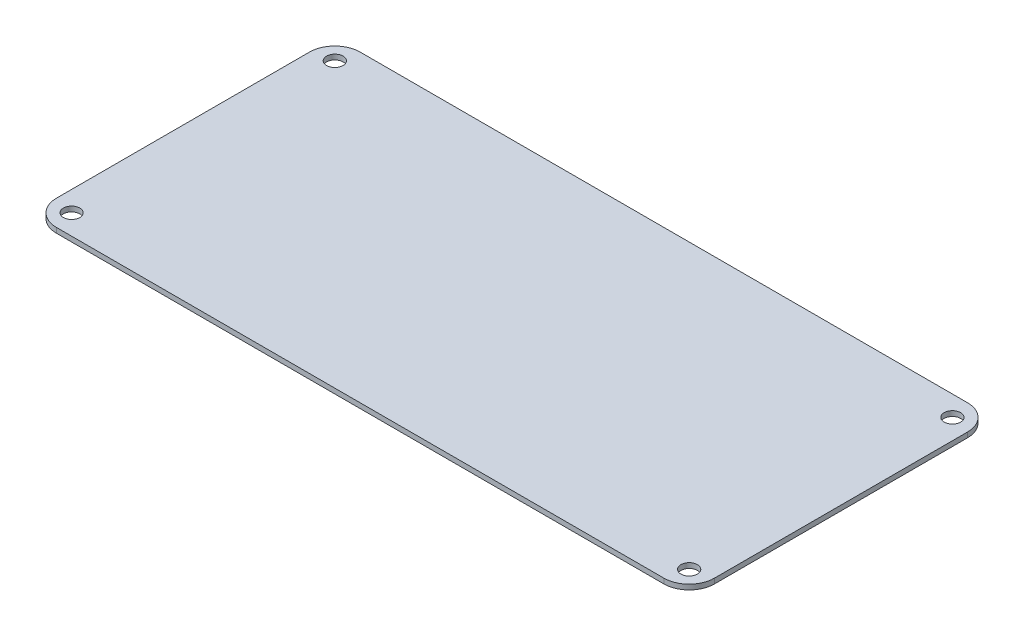
from build123d import *

# Parameters (mm, degrees)
EXTRUDE_1_DEPTH     = 2
SKETCH_3_R          = 3.25
CUT_EXTRUDE_2_DEPTH = 15


with BuildPart() as part:
    # 草图1 → 凸台-拉伸1 (new body)
    with BuildSketch(Plane(origin=(0, 0, 0), x_dir=(1, 0, 0), z_dir=(0, 1, 0))):
        with BuildLine():
            Line((-130, 50), (-130, -50))
            ThreePointArc((-130, -50), (-127.071067812, -57.071067812), (-120, -60))
            Line((-120, -60), (120, -60))
            ThreePointArc((120, -60), (127.071067812, -57.071067812), (130, -50))
            Line((130, -50), (130, 50))
            ThreePointArc((130, 50), (127.071067812, 57.071067812), (120, 60))
            Line((120, 60), (-120, 60))
            ThreePointArc((-120, 60), (-127.071067812, 57.071067812), (-130, 50))
        make_face()
    extrude(amount=EXTRUDE_1_DEPTH)

    # 草图3 → 切除-拉伸2 (cut)
    with BuildSketch(Plane(origin=(0, 2, 0), x_dir=(1, 0, 0), z_dir=(0, 1, 0))):
        with Locations(Location((-122, 52, 0), (0, 0, 270))):
            Circle(SKETCH_3_R)
        with Locations(Location((-122, -52, 0), (0, 0, 270))):
            Circle(SKETCH_3_R)
        with Locations(Location((122, -52, 0), (0, 0, 270))):
            Circle(SKETCH_3_R)
        with Locations(Location((122, 52, 0), (0, 0, 270))):
            Circle(SKETCH_3_R)
    extrude(amount=-CUT_EXTRUDE_2_DEPTH, mode=Mode.SUBTRACT)


solid = part.part
